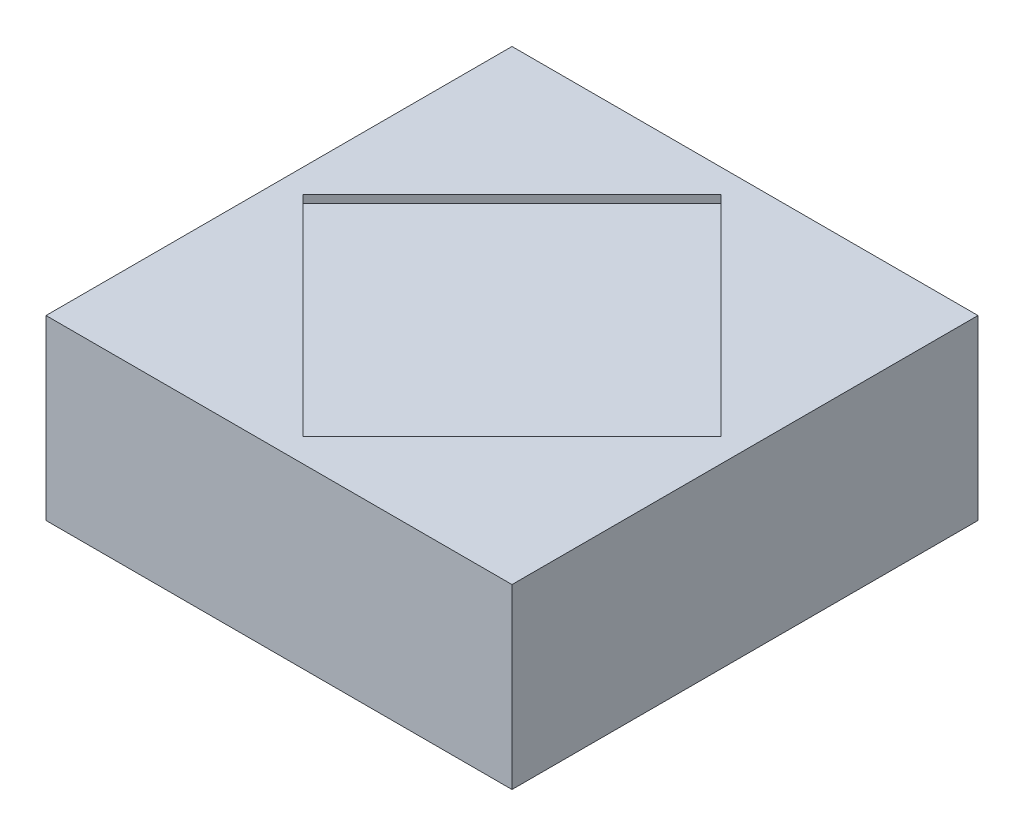
from build123d import *

# Parameters (mm, degrees)
SKETCH1_W           = 31.5
SKETCH1_H           = 31.5
BOSS_EXTRUDE1_DEPTH = 12
CUT_EXTRUDE1_DEPTH  = 0.5


with BuildPart() as part:
    # Sketch1 → Boss-Extrude1 (new body)
    with BuildSketch(Plane(origin=(0, 0, 0), x_dir=(1, 0, 0), z_dir=(0, 1, 0))):
        with Locations((15.75, 15.75)):
            Rectangle(SKETCH1_W, SKETCH1_H)
    extrude(amount=BOSS_EXTRUDE1_DEPTH)

    # Sketch3 → Cut-Extrude1 (cut)
    with BuildSketch(Plane(origin=(0, 12, 0), x_dir=(1, 0, 0), z_dir=(0, 1, 0))):
        Polygon((1.607864376, 15.75), (15.75, 1.607864376), (29.892135624, 15.75), (15.75, 29.892135624), align=None)
    extrude(amount=-CUT_EXTRUDE1_DEPTH, mode=Mode.SUBTRACT)


solid = part.part
